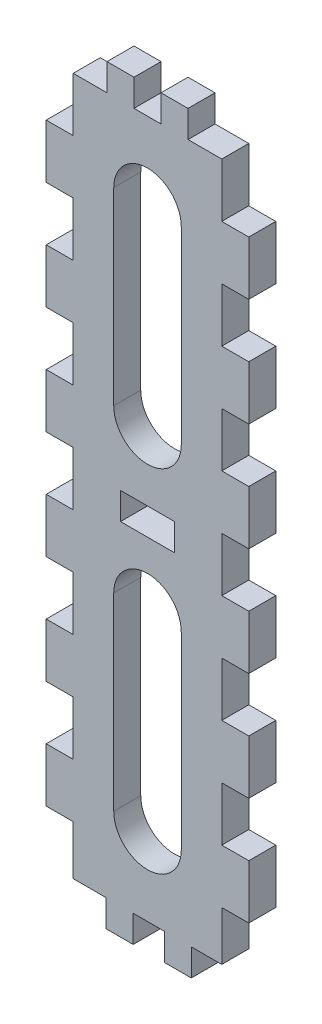
from build123d import *

# Parameters (mm, degrees)
SKETCH1_W               = 47.625
SKETCH1_H               = 163.99508231
BOSS_EXTRUDE1_DEPTH     = 6.35
SKETCH3_W               = 6.35
SKETCH3_H               = 12.7
BOSS_EXTRUDE2_DEPTH     = 6.35
SKETCH4_W               = 12.7
SKETCH4_H               = 12.7
CUT_EXTRUDE1_DEPTH      = 184.110936969
LPATTERN1_COUNT         = 7
LPATTERN1_PITCH         = 25.4
WEIGHT_SAVINGS_DEPTH    = 184.110936969
SKETCH6_W               = 12.7
SKETCH6_H               = 6.35
CENTER_PANEL_MATE_DEPTH = 184.110936969


with BuildPart() as part:
    # Sketch1 → Boss-Extrude1 (new body)
    with BuildSketch(Plane.XY):
        with Locations((-23.8125, -88.347541155)):
            Rectangle(SKETCH1_W, SKETCH1_H)
    extrude(amount=-BOSS_EXTRUDE1_DEPTH)

    # Sketch3 → Boss-Extrude2 (add)
    with BuildSketch(Plane.XY):
        with Locations((-17.4625, -6.35)):
            Rectangle(SKETCH3_W, SKETCH3_H)
        with Locations((-30.1625, -6.35)):
            Rectangle(SKETCH3_W, SKETCH3_H)
        with Locations((-30.351439005, -170.34508231)):
            Rectangle(SKETCH3_W, SKETCH3_H)
        with Locations((-16.694467166, -170.34508231)):
            Rectangle(SKETCH3_W, SKETCH3_H)
    extrude(amount=-BOSS_EXTRUDE2_DEPTH)

    # Sketch4 → Cut-Extrude1 (cut, through all)
    with BuildSketch(Plane.XY):
        with Locations((0, -12.7)):
            Rectangle(SKETCH4_W, SKETCH4_H)
        with Locations((-47.625, -12.7)):
            Rectangle(SKETCH4_W, SKETCH4_H)
    cut_extrude1 = extrude(amount=-CUT_EXTRUDE1_DEPTH, mode=Mode.SUBTRACT)

    # LPattern1: Cut-Extrude1 ×7
    with Locations(*[(0, -i * LPATTERN1_PITCH, 0) for i in range(1, LPATTERN1_COUNT)]):
        add(cut_extrude1, mode=Mode.SUBTRACT)

    # Sketch5 → Weight savings (cut, through all)
    with BuildSketch(Plane.XY):
        with BuildLine():
            Line((-15.875, -107.397541155), (-15.875, -151.847541155))
            ThreePointArc((-15.875, -151.847541155), (-23.8125, -159.785041155), (-31.75, -151.847541155))
            Line((-31.75, -151.847541155), (-31.75, -107.397541155))
            ThreePointArc((-31.75, -107.397541155), (-23.8125, -99.460041155), (-15.875, -107.397541155))
        make_face()
        with BuildLine():
            Line((-31.75, -69.297541155), (-31.75, -24.847541155))
            ThreePointArc((-31.75, -24.847541155), (-23.8125, -16.910041155), (-15.875, -24.847541155))
            Line((-15.875, -24.847541155), (-15.875, -69.297541155))
            ThreePointArc((-15.875, -69.297541155), (-23.8125, -77.235041155), (-31.75, -69.297541155))
        make_face()
    extrude(amount=-WEIGHT_SAVINGS_DEPTH, mode=Mode.SUBTRACT)

    # Sketch6 → Center Panel Mate (cut, through all)
    with BuildSketch(Plane(origin=(0, 0, -6.35), x_dir=(-1, 0, 0), z_dir=(0, 0, -1))):
        with Locations((23.8125, -88.9)):
            Rectangle(SKETCH6_W, SKETCH6_H)
    extrude(amount=-CENTER_PANEL_MATE_DEPTH, mode=Mode.SUBTRACT)


solid = part.part
